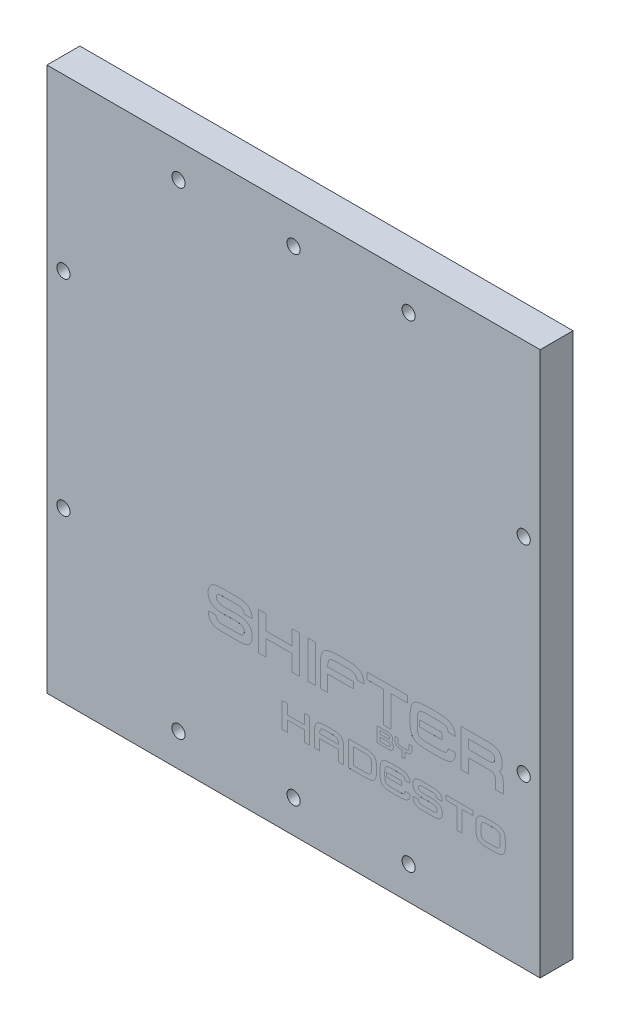
from build123d import *

# Parameters (mm, degrees)
SZKIC1_W                    = 150
SZKIC1_H                    = 10
DODANIE_WYCI_GNI_CIE1_DEPTH = 165.5
SZKIC3_W                    = 2.340552273
SZKIC3_H                    = 11.4427
WYTNIJ_WYCI_GNI_CIE4_DEPTH  = 0.001
SZKIC2_R                    = 2
WYTNIJ_WYCI_GNI_CIE5_DEPTH  = 10


with BuildPart() as part:
    # Szkic1 → Dodanie-wyciągnięcie1 (new body)
    with BuildSketch(Plane(origin=(0, 0, 0), x_dir=(1, 0, 0), z_dir=(0, 1, 0))):
        Rectangle(SZKIC1_W, SZKIC1_H)
    extrude(amount=DODANIE_WYCI_GNI_CIE1_DEPTH)

    # Szkic3 → Wytnij-wyciągnięcie4 (cut)
    # profile 1 of 18: a face of its own
    with BuildSketch(Plane.XY.offset(5)):
        with BuildLine():
            Line((-16.542512568, 42.832400391), (-22.123288858, 42.832400391))
            add(Edge.make_bspline(
                [(-22.123288858, 42.832400391), (-22.422042313, 42.83440431), (-22.858237206, 42.854045396), (-23.414230973, 42.947728336), (-23.788781499, 43.040027305), (-24.133562425, 43.16208995), (-24.448277119, 43.312277598), (-24.734944472, 43.48711761), (-24.987217214, 43.694905585), (-25.213935653, 43.923582429), (-25.40889511, 44.18272049), (-25.568697724, 44.470268147), (-25.704906368, 44.782595342), (-25.806269964, 45.123449133), (-25.905832807, 45.628008445), (-25.927296998, 46.024411422), (-25.928150611, 46.29519945)],
                knots=[0, 0, 0, 0, 0.151922302, 0.221134811, 0.286191508, 0.347688773, 0.406612918, 0.463100543, 0.517821253, 0.572256363, 0.626379647, 0.681995079, 0.739047103, 0.799173433, 0.862284251, 1, 1, 1, 1], degree=3))
            Line((-25.928150611, 46.29519945), (-23.554797806, 46.29519945))
            add(Edge.make_bspline(
                [(-23.554797806, 46.29519945), (-23.554751578, 46.180821676), (-23.543199145, 46.012793928), (-23.494151101, 45.800661123), (-23.448821313, 45.655663212), (-23.384262854, 45.524487166), (-23.308496532, 45.403352549), (-23.220325966, 45.291489786), (-23.112188471, 45.196830265), (-22.995870738, 45.107855531), (-22.862409534, 45.037017564), (-22.718445996, 44.971797356), (-22.558618614, 44.921453905), (-22.385425517, 44.881806383), (-22.127733043, 44.844186109), (-21.926944375, 44.830376724), (-21.788254849, 44.833232865)],
                knots=[0, 0, 0, 0, 0.130945227, 0.191386142, 0.248712215, 0.304229169, 0.357994818, 0.411967713, 0.466330735, 0.52187641, 0.57903531, 0.638605761, 0.702428631, 0.770231885, 0.841588023, 1, 1, 1, 1], degree=3))
            Line((-21.788254849, 44.833232865), (-16.971262384, 44.833232865))
            add(Edge.make_bspline(
                [(-16.971262384, 44.833232865), (-16.821141413, 44.833628326), (-16.603768932, 44.841681391), (-16.324615723, 44.865274956), (-16.13989718, 44.8953397), (-15.969591836, 44.924807053), (-15.774349275, 44.985256326), (-15.63567933, 45.034258072), (-15.553810807, 45.081579753)],
                knots=[0, 0, 0, 0, 0.310014709, 0.449362834, 0.57828042, 0.696618046, 0.805874912, 1, 1, 1, 1], degree=3))
            add(Edge.make_bspline(
                [(-15.553810807, 45.081579753), (-15.460602348, 45.133303576), (-15.331832672, 45.230409308), (-15.19807949, 45.397361959), (-15.115563301, 45.537486301), (-15.056089605, 45.695884437), (-14.988220052, 45.933334048), (-14.980933036, 46.126610238), (-14.977458596, 46.257713127)],
                knots=[0, 0, 0, 0, 0.232178092, 0.345784315, 0.463841982, 0.584405484, 0.713048125, 1, 1, 1, 1], degree=3))
            add(Edge.make_bspline(
                [(-14.977458596, 46.257713127), (-14.980271312, 46.40533732), (-15.00149924, 46.626881944), (-15.118055232, 46.890480367), (-15.230426364, 47.065929681), (-15.377935917, 47.22144953), (-15.626308287, 47.409416515), (-15.849207901, 47.507276559), (-16.005989575, 47.56036284)],
                knots=[0, 0, 0, 0, 0.249244707, 0.364726436, 0.480163662, 0.596825915, 0.721946619, 1, 1, 1, 1], degree=3))
            add(Edge.make_bspline(
                [(-16.005989575, 47.56036284), (-16.127688045, 47.602586001), (-16.323407595, 47.652868698), (-16.600262479, 47.703711254), (-16.83640478, 47.735935271), (-17.092731641, 47.761398711), (-17.473729914, 47.787855732), (-17.770225288, 47.789088397), (-17.974021516, 47.792309462)],
                knots=[0, 0, 0, 0, 0.194054864, 0.304223373, 0.424292964, 0.553297749, 0.692567507, 1, 1, 1, 1], degree=3))
            add(Edge.make_bspline(
                [(-17.974021516, 47.792309462), (-18.19583284, 47.791502098), (-18.562227009, 47.787132529), (-19.095478158, 47.767764039), (-19.574218875, 47.752477923), (-20.052959821, 47.737205105), (-20.589331817, 47.717682568), (-20.958854281, 47.713493879), (-21.183787896, 47.712651026)],
                knots=[0, 0, 0, 0, 0.207249272, 0.342308609, 0.498540821, 0.654773034, 0.789832371, 1, 1, 1, 1], degree=3))
            add(Edge.make_bspline(
                [(-21.183787896, 47.712651026), (-21.521268187, 47.715698564), (-22.011347572, 47.725391699), (-22.64087422, 47.782392924), (-23.063495877, 47.844340351), (-23.454221965, 47.917465826), (-23.914411838, 48.033270903), (-24.234064535, 48.156260402), (-24.431040598, 48.251516915)],
                knots=[0, 0, 0, 0, 0.30527379, 0.442865584, 0.571301332, 0.691382806, 0.802202654, 1, 1, 1, 1], degree=3))
            add(Edge.make_bspline(
                [(-24.431040598, 48.251516915), (-24.678585657, 48.374955388), (-25.02010852, 48.607182622), (-25.390618379, 49.003012411), (-25.610113018, 49.336822914), (-25.782951694, 49.705898653), (-25.948818692, 50.267042586), (-25.994557451, 50.716961898), (-25.99140878, 51.025504794)],
                knots=[0, 0, 0, 0, 0.246159863, 0.363761762, 0.480637741, 0.600407148, 0.72535946, 1, 1, 1, 1], degree=3))
            add(Edge.make_bspline(
                [(-25.99140878, 51.025504794), (-25.992671009, 51.30386528), (-25.962644752, 51.709810702), (-25.847204543, 52.222593888), (-25.731324459, 52.564909214), (-25.578261041, 52.874494673), (-25.328611286, 53.243448454), (-25.093054098, 53.479195229), (-24.913677003, 53.607375269)],
                knots=[0, 0, 0, 0, 0.287331641, 0.417924524, 0.541529787, 0.65938178, 0.773151266, 1, 1, 1, 1], degree=3))
            add(Edge.make_bspline(
                [(-24.913677003, 53.607375269), (-24.753614732, 53.724319382), (-24.485377703, 53.872690053), (-24.092205872, 54.022608316), (-23.760082019, 54.114353589), (-23.399191073, 54.187372908), (-22.861876031, 54.255882271), (-22.442534011, 54.278361983), (-22.153746495, 54.275100391)],
                knots=[0, 0, 0, 0, 0.205829485, 0.317155703, 0.436984505, 0.563784613, 0.699797751, 1, 1, 1, 1], degree=3))
            Line((-22.153746495, 54.275100391), (-16.844746045, 54.275100391))
            add(Edge.make_bspline(
                [(-16.844746045, 54.275100391), (-16.514040808, 54.272924598), (-16.032033705, 54.253763699), (-15.416670144, 54.159747702), (-15.002368741, 54.06776744), (-14.621519295, 53.945534416), (-14.272083177, 53.798761474), (-13.956715796, 53.622998872), (-13.674421528, 53.419373768), (-13.424590186, 53.189850015), (-13.209403882, 52.93059789), (-13.025222176, 52.646608417), (-12.877829866, 52.332975907), (-12.759765428, 51.994929061), (-12.648872615, 51.492234481), (-12.620484094, 51.096865101), (-12.620506057, 50.826358704)],
                knots=[0, 0, 0, 0, 0.159185356, 0.231380934, 0.299177103, 0.363086624, 0.423506478, 0.48118809, 0.536338715, 0.590564411, 0.643900735, 0.697976609, 0.752917048, 0.810175151, 0.869863143, 1, 1, 1, 1], degree=3))
            Line((-12.620506057, 50.826358704), (-15.071174403, 50.826358704))
            add(Edge.make_bspline(
                [(-15.071174403, 50.826358704), (-15.069084386, 50.941194158), (-15.085497121, 51.108674253), (-15.135082008, 51.32206839), (-15.189960397, 51.465470651), (-15.257396978, 51.598776984), (-15.343857263, 51.718369873), (-15.441143176, 51.830400105), (-15.558885497, 51.925475528), (-15.687276765, 52.01433989), (-15.834713334, 52.084984287), (-15.994579215, 52.149620804), (-16.170624962, 52.200007747), (-16.361646037, 52.240183375), (-16.646034333, 52.276891745), (-16.867710257, 52.291635872), (-17.020463182, 52.288325289)],
                knots=[0, 0, 0, 0, 0.12373596, 0.180989677, 0.235950535, 0.289116884, 0.341745777, 0.394885382, 0.448749002, 0.504633205, 0.563072603, 0.624754491, 0.690648222, 0.760423942, 0.835299916, 1, 1, 1, 1], degree=3))
            Line((-17.020463182, 52.288325289), (-22.027230156, 52.288325289))
            add(Edge.make_bspline(
                [(-22.027230156, 52.288325289), (-22.237115902, 52.286860891), (-22.540500366, 52.259159743), (-22.897172127, 52.117204324), (-23.106326436, 51.974149472), (-23.267138631, 51.785357048), (-23.427708095, 51.464386689), (-23.455416988, 51.182927545), (-23.458739104, 50.992704261)],
                knots=[0, 0, 0, 0, 0.28617742, 0.406448566, 0.51760179, 0.626596097, 0.739419835, 1, 1, 1, 1], degree=3))
            add(Edge.make_bspline(
                [(-23.458739104, 50.992704261), (-23.45695375, 50.885682649), (-23.439665203, 50.725253112), (-23.361059869, 50.52938136), (-23.283755313, 50.393993025), (-23.181156667, 50.270810543), (-23.054833178, 50.160932127), (-22.9080302, 50.05933582), (-22.738989471, 49.96858367), (-22.548166298, 49.88918654), (-22.334753976, 49.821303193), (-22.099638703, 49.76436891), (-21.841887333, 49.714057612), (-21.56171571, 49.677687015), (-21.14388052, 49.643420843), (-20.819267432, 49.632185419), (-20.595721208, 49.633825064)],
                knots=[0, 0, 0, 0, 0.091832613, 0.135566021, 0.179507576, 0.224524878, 0.271785124, 0.322123736, 0.37675359, 0.435361319, 0.498445969, 0.567862779, 0.641920655, 0.722688477, 0.809064572, 1, 1, 1, 1], degree=3))
            add(Edge.make_bspline(
                [(-20.595721208, 49.633825064), (-20.384712024, 49.631285659), (-20.041132218, 49.644982602), (-19.546760779, 49.663890455), (-19.113461183, 49.688023749), (-18.681605734, 49.710040531), (-18.196079055, 49.735661584), (-17.860013454, 49.74084446), (-17.655387773, 49.743941137)],
                knots=[0, 0, 0, 0, 0.215036783, 0.350500079, 0.504366675, 0.657438174, 0.791346006, 1, 1, 1, 1], degree=3))
            add(Edge.make_bspline(
                [(-17.655387773, 49.743941137), (-17.301296909, 49.744241875), (-16.787103202, 49.727570637), (-16.126156643, 49.665713964), (-15.682495499, 49.596133448), (-15.272134722, 49.515328707), (-14.790163515, 49.377024979), (-14.451388989, 49.248296027), (-14.246475303, 49.137131288)],
                knots=[0, 0, 0, 0, 0.304044834, 0.441512067, 0.569747136, 0.689567347, 0.800388045, 1, 1, 1, 1], degree=3))
            add(Edge.make_bspline(
                [(-14.246475303, 49.137131288), (-13.980059598, 49.001536034), (-13.616274354, 48.748407121), (-13.217615902, 48.328182965), (-12.980940618, 47.981234354), (-12.79664715, 47.599777454), (-12.617048256, 47.028830496), (-12.569768568, 46.570196797), (-12.571305258, 46.257713127)],
                knots=[0, 0, 0, 0, 0.254403592, 0.373969577, 0.491718452, 0.610755608, 0.733648628, 1, 1, 1, 1], degree=3))
            add(Edge.make_bspline(
                [(-12.571305258, 46.257713127), (-12.572216669, 45.966442467), (-12.597140005, 45.540817733), (-12.712795989, 45.002927774), (-12.829953285, 44.643718233), (-12.979623966, 44.31586119), (-13.223840642, 43.922559529), (-13.462019798, 43.672190527), (-13.639665455, 43.530583151)],
                knots=[0, 0, 0, 0, 0.288468082, 0.419707501, 0.543339316, 0.661573202, 0.775413558, 1, 1, 1, 1], degree=3))
            add(Edge.make_bspline(
                [(-13.639665455, 43.530583151), (-13.795597672, 43.404960412), (-14.068400603, 43.254275437), (-14.467840402, 43.09506499), (-14.816060597, 43.002058858), (-15.196834225, 42.924099613), (-15.775724033, 42.85171901), (-16.228909172, 42.833093055), (-16.542512568, 42.832400391)],
                knots=[0, 0, 0, 0, 0.196904714, 0.30637113, 0.424122327, 0.552441328, 0.690159053, 1, 1, 1, 1], degree=3))
        make_face()
    # profile 2 of 18: a face of its own
    with BuildSketch(Plane.XY.offset(5)):
        Polygon((1.874986347, 42.832400391), (-0.465565926, 42.832400391), (-0.465565926, 47.743108663), (-8.328322109, 47.743108663), (-8.328322109, 42.832400391), (-10.668874382, 42.832400391), (-10.668874382, 54.275100391), (-8.328322109, 54.275100391), (-8.328322109, 49.727540871), (-0.465565926, 49.727540871), (-0.465565926, 54.275100391), (1.874986347, 54.275100391), align=None)
    # profile 3 of 18: a face of its own
    with BuildSketch(Plane.XY.offset(5)):
        with Locations((5.535760047, 48.553750391)):
            Rectangle(SZKIC3_W, SZKIC3_H)
    # profile 4 of 18: a face of its own
    with BuildSketch(Plane.XY.offset(5)):
        with BuildLine():
            Line((10.353923959, 49.680682967), (18.204965667, 49.680682967))
            Line((18.204965667, 49.680682967), (18.204965667, 47.775909196))
            Line((18.204965667, 47.775909196), (10.353923959, 47.775909196))
            Line((10.353923959, 47.775909196), (10.353923959, 42.832400391))
            Line((10.353923959, 42.832400391), (8.12348776, 42.832400391))
            Line((8.12348776, 42.832400391), (8.139888026, 48.766953852))
            add(Edge.make_bspline(
                [(8.139888026, 48.766953852), (8.136223824, 49.129546201), (8.151663373, 49.65378104), (8.18690294, 50.325673132), (8.230349031, 50.769284594), (8.280490386, 51.172791681), (8.358692705, 51.634403035), (8.445107441, 51.956217604), (8.512408357, 52.154780264)],
                knots=[0, 0, 0, 0, 0.317800877, 0.459770024, 0.58976232, 0.708488739, 0.816214059, 1, 1, 1, 1], degree=3))
            add(Edge.make_bspline(
                [(8.512408357, 52.154780264), (8.582274378, 52.353614737), (8.71519439, 52.637438112), (8.942050988, 52.98197737), (9.138715725, 53.211040751), (9.360227911, 53.415379149), (9.692141158, 53.661457269), (9.973024409, 53.80268049), (10.168835241, 53.881494003)],
                knots=[0, 0, 0, 0, 0.255571256, 0.378596101, 0.499596222, 0.62099289, 0.743641103, 1, 1, 1, 1], degree=3))
            add(Edge.make_bspline(
                [(10.168835241, 53.881494003), (10.377082685, 53.968033784), (10.71953271, 54.063973302), (11.206894843, 54.167138049), (11.6306627, 54.226966509), (12.093719739, 54.280280402), (12.790592332, 54.325932897), (13.333899816, 54.338822675), (13.70894984, 54.338358561)],
                knots=[0, 0, 0, 0, 0.188096828, 0.296817254, 0.416307633, 0.54573704, 0.686461057, 1, 1, 1, 1], degree=3))
            Line((13.70894984, 54.338358561), (15.775383378, 54.338358561))
            add(Edge.make_bspline(
                [(15.775383378, 54.338358561), (16.255209059, 54.338412348), (16.945479394, 54.31948511), (17.824275929, 54.240879395), (18.39191393, 54.156796874), (18.900204065, 54.054062463), (19.463954239, 53.888406519), (19.84825419, 53.724997963), (20.067567326, 53.581603422)],
                knots=[0, 0, 0, 0, 0.326658008, 0.469759159, 0.600360482, 0.717142396, 0.822452319, 1, 1, 1, 1], degree=3))
            add(Edge.make_bspline(
                [(20.067567326, 53.581603422), (20.270837029, 53.449322563), (20.551412534, 53.204296377), (20.848042374, 52.79975726), (21.047041147, 52.453349125), (21.207848937, 52.061357752), (21.398188792, 51.465447445), (21.472882524, 50.984445776), (21.510790749, 50.652984462)],
                knots=[0, 0, 0, 0, 0.215512447, 0.327131176, 0.444654477, 0.569707877, 0.702963159, 1, 1, 1, 1], degree=3))
            Line((21.510790749, 50.652984462), (19.29441192, 50.652984462))
            add(Edge.make_bspline(
                [(19.29441192, 50.652984462), (19.253817319, 50.830632383), (19.174942613, 51.083649952), (19.027524262, 51.391592759), (18.899628808, 51.585413537), (18.755971052, 51.753524747), (18.542709387, 51.944006075), (18.351939602, 52.042821721), (18.219023038, 52.0891792)],
                knots=[0, 0, 0, 0, 0.291343801, 0.422029009, 0.544636847, 0.661527919, 0.774773501, 1, 1, 1, 1], degree=3))
            add(Edge.make_bspline(
                [(18.219023038, 52.0891792), (18.09319646, 52.1353921), (17.877232283, 52.177426153), (17.562237386, 52.224204051), (17.266654904, 52.253499004), (16.931477541, 52.276693371), (16.40348422, 52.297990426), (15.98713667, 52.307902106), (15.695724942, 52.304725555)],
                knots=[0, 0, 0, 0, 0.157646713, 0.259244268, 0.376058952, 0.508256356, 0.655950337, 1, 1, 1, 1], degree=3))
            Line((15.695724942, 52.304725555), (13.821408808, 52.304725555))
            add(Edge.make_bspline(
                [(13.821408808, 52.304725555), (13.497975016, 52.303921956), (13.036562209, 52.294028746), (12.453870568, 52.252939014), (12.087623734, 52.209917474), (11.769433331, 52.151292861), (11.433151857, 52.070181379), (11.210571745, 51.981220496), (11.089593042, 51.899404691)],
                knots=[0, 0, 0, 0, 0.347896457, 0.49613181, 0.628133571, 0.744281889, 0.843901062, 1, 1, 1, 1], degree=3))
            add(Edge.make_bspline(
                [(11.089593042, 51.899404691), (10.967170148, 51.823022711), (10.814408676, 51.653779218), (10.657200962, 51.377480222), (10.559466136, 51.117423404), (10.477762448, 50.817757718), (10.390625634, 50.336467186), (10.361540518, 49.951035556), (10.353923959, 49.680682967)],
                knots=[0, 0, 0, 0, 0.177190849, 0.27882497, 0.393352803, 0.521096447, 0.664120496, 1, 1, 1, 1], degree=3))
        make_face()
    # profile 5 of 18: a face of its own
    with BuildSketch(Plane.XY.offset(5)):
        Polygon((34.670832907, 52.274267918), (29.647665667, 52.274267918), (29.647665667, 42.832400391), (27.307113394, 42.832400391), (27.307113394, 52.274267918), (22.300346421, 52.274267918), (22.300346421, 54.275100391), (34.670832907, 54.275100391), align=None)
    # profile 6 of 18: a face of its own
    with BuildSketch(Plane.XY.offset(5)):
        with BuildLine():
            Line((43.43091794, 42.832400391), (40.968535118, 42.832400391))
            add(Edge.make_bspline(
                [(40.968535118, 42.832400391), (40.60058593, 42.833056305), (40.06825061, 42.844083204), (39.385642583, 42.884778609), (38.93296567, 42.928242202), (38.521359549, 42.987433129), (38.047403672, 43.07165289), (37.716125182, 43.161533809), (37.512764746, 43.237721255)],
                knots=[0, 0, 0, 0, 0.315853452, 0.456901686, 0.586909503, 0.706079852, 0.813768451, 1, 1, 1, 1], degree=3))
            add(Edge.make_bspline(
                [(37.512764746, 43.237721255), (37.315728976, 43.308009758), (37.037146251, 43.446637441), (36.699043067, 43.679065409), (36.476653103, 43.880646821), (36.274342821, 44.10202241), (36.037313876, 44.438429081), (35.893724181, 44.716693386), (35.821194434, 44.915234196)],
                knots=[0, 0, 0, 0, 0.254655329, 0.377777486, 0.499185872, 0.619886156, 0.742779715, 1, 1, 1, 1], degree=3))
            add(Edge.make_bspline(
                [(35.821194434, 44.915234196), (35.744043857, 45.118426625), (35.657336607, 45.450403965), (35.566766037, 45.923288649), (35.513672184, 46.335879589), (35.464617841, 46.78788473), (35.426218548, 47.470835579), (35.413626065, 48.002990955), (35.413530675, 48.371004568)],
                knots=[0, 0, 0, 0, 0.1862133, 0.294014373, 0.413080626, 0.543143086, 0.684177498, 1, 1, 1, 1], degree=3))
            add(Edge.make_bspline(
                [(35.413530675, 48.371004568), (35.412936909, 48.763899205), (35.421050273, 49.33054653), (35.459246675, 50.05605102), (35.49899348, 50.532586306), (35.547156871, 50.965713706), (35.622299257, 51.455469171), (35.702364402, 51.797455125), (35.767307846, 52.007177869)],
                knots=[0, 0, 0, 0, 0.321609357, 0.463728706, 0.594586506, 0.712970982, 0.820379201, 1, 1, 1, 1], degree=3))
            add(Edge.make_bspline(
                [(35.767307846, 52.007177869), (35.83422884, 52.22084636), (35.960580263, 52.527127678), (36.186872055, 52.895997494), (36.379192316, 53.139971538), (36.594632215, 53.359533756), (36.923232449, 53.615618743), (37.200046647, 53.766517136), (37.395619987, 53.846350576)],
                knots=[0, 0, 0, 0, 0.264263494, 0.388825993, 0.509593675, 0.630160731, 0.750928413, 1, 1, 1, 1], degree=3))
            add(Edge.make_bspline(
                [(37.395619987, 53.846350576), (37.604824373, 53.936854215), (37.950123758, 54.038589509), (38.443057608, 54.143397241), (38.872804041, 54.207097563), (39.344869683, 54.258393767), (40.057821571, 54.308840807), (40.614554399, 54.323459087), (40.998992755, 54.321958295)],
                knots=[0, 0, 0, 0, 0.186673139, 0.294793961, 0.413464869, 0.543078359, 0.684474125, 1, 1, 1, 1], degree=3))
            Line((40.998992755, 54.321958295), (43.463718472, 54.321958295))
            add(Edge.make_bspline(
                [(43.463718472, 54.321958295), (43.938862705, 54.320203949), (44.625895517, 54.300588702), (45.502134707, 54.208583041), (46.078559169, 54.11230024), (46.601824345, 53.99350365), (47.201504859, 53.8015602), (47.611708877, 53.611042169), (47.851961122, 53.452744187)],
                knots=[0, 0, 0, 0, 0.314844944, 0.454823659, 0.583341739, 0.701810237, 0.809960191, 1, 1, 1, 1], degree=3))
            add(Edge.make_bspline(
                [(47.851961122, 53.452744187), (48.067805964, 53.313458983), (48.367020437, 53.069970671), (48.679214178, 52.669305056), (48.870893991, 52.343640434), (49.018892871, 51.986322437), (49.162747212, 51.455934757), (49.199467621, 51.034132015), (49.199125843, 50.746700269)],
                knots=[0, 0, 0, 0, 0.243950048, 0.361591219, 0.48010578, 0.601286494, 0.727241657, 1, 1, 1, 1], degree=3))
            Line((49.199125843, 50.746700269), (46.952289377, 50.746700269))
            add(Edge.make_bspline(
                [(46.952289377, 50.746700269), (46.950173465, 50.914216269), (46.933249927, 51.160442393), (46.829300311, 51.457243325), (46.732765178, 51.648663216), (46.599602042, 51.810394898), (46.38295567, 51.998773839), (46.181896844, 52.091724592), (46.040903157, 52.136037103)],
                knots=[0, 0, 0, 0, 0.281221084, 0.405304002, 0.523085054, 0.637090674, 0.752606565, 1, 1, 1, 1], degree=3))
            add(Edge.make_bspline(
                [(46.040903157, 52.136037103), (45.909067367, 52.17464452), (45.685527921, 52.215464552), (45.357175994, 52.25107215), (45.047007313, 52.276516474), (44.693178449, 52.297809414), (44.133923822, 52.31560906), (43.692605373, 52.322927904), (43.384060036, 52.321125821)],
                knots=[0, 0, 0, 0, 0.154176449, 0.254889692, 0.37115572, 0.503932808, 0.653245043, 1, 1, 1, 1], degree=3))
            Line((43.384060036, 52.321125821), (41.111451724, 52.321125821))
            add(Edge.make_bspline(
                [(41.111451724, 52.321125821), (40.784879881, 52.320478249), (40.318051183, 52.310116527), (39.728283243, 52.269517972), (39.355885514, 52.225965791), (39.032111498, 52.167997932), (38.687804122, 52.085743817), (38.458914494, 51.997509192), (38.332778054, 51.915804957)],
                knots=[0, 0, 0, 0, 0.345644478, 0.493985201, 0.625519724, 0.742252533, 0.841884301, 1, 1, 1, 1], degree=3))
            add(Edge.make_bspline(
                [(38.332778054, 51.915804957), (38.209061774, 51.833443052), (38.048617236, 51.656765416), (37.898372694, 51.35926945), (37.80234677, 51.080480559), (37.72226188, 50.757700477), (37.646751989, 50.236346808), (37.627380703, 49.820220848), (37.625223714, 49.528394781)],
                knots=[0, 0, 0, 0, 0.172182951, 0.272744527, 0.386755583, 0.515243516, 0.659813711, 1, 1, 1, 1], degree=3))
            Line((37.625223714, 49.528394781), (37.627566609, 47.923511591))
            add(Edge.make_bspline(
                [(37.627566609, 47.923511591), (37.626891047, 47.593092448), (37.635554035, 47.121468762), (37.706987468, 46.531126992), (37.777885272, 46.166371253), (37.869652707, 45.853275373), (38.014992757, 45.525904117), (38.168446569, 45.323759612), (38.295291732, 45.231525043)],
                knots=[0, 0, 0, 0, 0.347584885, 0.494830619, 0.624602041, 0.737837282, 0.837036243, 1, 1, 1, 1], degree=3))
            add(Edge.make_bspline(
                [(38.295291732, 45.231525043), (38.415470932, 45.145915949), (38.639900887, 45.052775719), (38.978276026, 44.962041594), (39.301131769, 44.902381803), (39.671972311, 44.856554191), (40.264059468, 44.812655556), (40.733261963, 44.799592207), (41.062250925, 44.800432332)],
                knots=[0, 0, 0, 0, 0.155206199, 0.255592002, 0.370997274, 0.502801868, 0.651395086, 1, 1, 1, 1], degree=3))
            Line((41.062250925, 44.800432332), (43.400460303, 44.800432332))
            add(Edge.make_bspline(
                [(43.400460303, 44.800432332), (43.716033311, 44.798650702), (44.165941186, 44.805856038), (44.734571903, 44.823680713), (45.091514411, 44.84510184), (45.402498124, 44.870232417), (45.727023702, 44.905749613), (45.945991077, 44.946290708), (46.073703689, 44.985521051)],
                knots=[0, 0, 0, 0, 0.352451819, 0.502580475, 0.635403884, 0.751817299, 0.851038538, 1, 1, 1, 1], degree=3))
            add(Edge.make_bspline(
                [(46.073703689, 44.985521051), (46.214761062, 45.028112184), (46.417111897, 45.118989494), (46.631125467, 45.311595937), (46.760984791, 45.47918579), (46.859063507, 45.675945186), (46.953365567, 45.989611981), (46.972416973, 46.245186002), (46.968689643, 46.421715789)],
                knots=[0, 0, 0, 0, 0.24156096, 0.354454704, 0.467197092, 0.585822661, 0.711271118, 1, 1, 1, 1], degree=3))
            Line((46.968689643, 46.421715789), (49.22958348, 46.421715789))
            add(Edge.make_bspline(
                [(49.22958348, 46.421715789), (49.230097622, 46.064842368), (49.19216756, 45.54714882), (49.025503305, 44.903510748), (48.85351015, 44.490822927), (48.634412134, 44.1265481), (48.272910225, 43.705927736), (47.924778333, 43.473283379), (47.676243984, 43.354866014)],
                knots=[0, 0, 0, 0, 0.294114227, 0.424501136, 0.545829666, 0.660956259, 0.7731031, 1, 1, 1, 1], degree=3))
            add(Edge.make_bspline(
                [(47.676243984, 43.354866014), (47.464912682, 43.254764253), (47.102207562, 43.135546131), (46.564847707, 43.028437096), (46.066434091, 42.957626779), (45.50227837, 42.898748718), (44.616392, 42.846961195), (43.918497908, 42.828993781), (43.43091794, 42.832400391)],
                knots=[0, 0, 0, 0, 0.162710407, 0.264981933, 0.38160847, 0.513497487, 0.660216093, 1, 1, 1, 1], degree=3))
        make_face()
    # profile 7 of 18: a face of its own
    with BuildSketch(Plane.XY.offset(5)):
        Polygon((45.17637484, 47.775909196), (38.332778054, 47.799338147), (38.332778054, 49.697083233), (45.17637484, 49.697083233), align=None)
    # profile 8 of 18: a face of its own
    with BuildSketch(Plane.XY.offset(5)):
        with BuildLine():
            Line((63.788334054, 42.832400391), (61.464182047, 42.832400391))
            Line((61.464182047, 42.832400391), (61.464182047, 45.015978688))
            add(Edge.make_bspline(
                [(61.464182047, 45.015978688), (61.463587156, 45.191086605), (61.453521007, 45.44512577), (61.404074283, 45.766974591), (61.359356385, 45.979485189), (61.2952878, 46.170728656), (61.218370206, 46.341870152), (61.12913159, 46.495053387), (61.022672444, 46.627809995), (60.897750388, 46.742866783), (60.753039743, 46.841461342), (60.587997631, 46.92615938), (60.401328237, 46.993730701), (60.19301329, 47.044529821), (59.875381317, 47.095138398), (59.624663463, 47.109726648), (59.451635098, 47.108184073)],
                knots=[0, 0, 0, 0, 0.155011784, 0.224175814, 0.287859163, 0.346835827, 0.402172914, 0.453585721, 0.503208761, 0.55209072, 0.603247683, 0.657619286, 0.715748493, 0.778404625, 0.846993692, 1, 1, 1, 1], degree=3))
            Line((59.451635098, 47.108184073), (53.266391855, 47.091783807))
            Line((53.266391855, 47.091783807), (53.266391855, 42.832400391))
            Line((53.266391855, 42.832400391), (50.989097751, 42.832400391))
            Line((50.989097751, 42.832400391), (50.989097751, 54.275100391))
            Line((50.989097751, 54.275100391), (59.292318226, 54.275100391))
            add(Edge.make_bspline(
                [(59.292318226, 54.275100391), (59.629522519, 54.277823501), (60.116953355, 54.25347755), (60.738166914, 54.166928674), (61.148237826, 54.080849225), (61.518437339, 53.962173264), (61.949187273, 53.782762266), (62.234832155, 53.598250901), (62.398997219, 53.455087083)],
                knots=[0, 0, 0, 0, 0.308563432, 0.445716134, 0.573699083, 0.691455971, 0.800969481, 1, 1, 1, 1], degree=3))
            add(Edge.make_bspline(
                [(62.398997219, 53.455087083), (62.574347885, 53.298789654), (62.803200113, 53.023062416), (63.043417941, 52.604027362), (63.187556567, 52.250343592), (63.303546526, 51.864713247), (63.409040464, 51.284747307), (63.440763003, 50.829866827), (63.439242674, 50.517096542)],
                knots=[0, 0, 0, 0, 0.218918775, 0.33232409, 0.450084974, 0.574981528, 0.707931514, 1, 1, 1, 1], degree=3))
            add(Edge.make_bspline(
                [(63.439242674, 50.517096542), (63.436538994, 50.236350811), (63.417543249, 49.832618123), (63.305625937, 49.333929449), (63.198079873, 49.021946554), (63.051734102, 48.757532485), (62.821466376, 48.464034431), (62.588379807, 48.312571362), (62.422426171, 48.246831124)],
                knots=[0, 0, 0, 0, 0.319412201, 0.455762304, 0.579143684, 0.692631121, 0.79729967, 1, 1, 1, 1], degree=3))
            add(Edge.make_bspline(
                [(62.422426171, 48.246831124), (62.531912145, 48.220350294), (62.69348586, 48.171083277), (62.886675994, 48.063632712), (63.022402142, 47.975773879), (63.14423214, 47.868384451), (63.257031702, 47.748296095), (63.361019857, 47.615326669), (63.449442669, 47.465346899), (63.52983876, 47.30264899), (63.599414644, 47.125487051), (63.657983591, 46.93340384), (63.70715717, 46.727736741), (63.7443796, 46.506988294), (63.778461841, 46.184401177), (63.789808773, 45.934645788), (63.788334054, 45.763362246)],
                knots=[0, 0, 0, 0, 0.109952973, 0.162653118, 0.214708369, 0.266962896, 0.320180924, 0.374896837, 0.430802819, 0.489253564, 0.5513401, 0.615754487, 0.684500673, 0.756955777, 0.83340111, 1, 1, 1, 1], degree=3))
            Line((63.788334054, 45.763362246), (63.788334054, 42.832400391))
        make_face()
        with BuildLine():
            Line((59.468035364, 52.068093143), (53.266391855, 52.068093143))
            Line((53.266391855, 52.068093143), (53.266391855, 49.298791055))
            Line((53.266391855, 49.298791055), (59.468035364, 49.298791055))
            add(Edge.make_bspline(
                [(59.468035364, 49.298791055), (59.713460564, 49.302597378), (60.068182937, 49.328025959), (60.48744934, 49.486550085), (60.730164252, 49.648004027), (60.920683054, 49.856529249), (61.105179387, 50.214119895), (61.14711558, 50.5265248), (61.145548304, 50.739671583)],
                knots=[0, 0, 0, 0, 0.292647434, 0.414933396, 0.527701918, 0.635233364, 0.746265615, 1, 1, 1, 1], degree=3))
            add(Edge.make_bspline(
                [(61.145548304, 50.739671583), (61.147844386, 50.936928083), (61.10350185, 51.227504629), (60.919457494, 51.55642004), (60.728288947, 51.747959429), (60.484699774, 51.893461725), (60.066951407, 52.04352407), (59.712935234, 52.06434136), (59.468035364, 52.068093143)],
                knots=[0, 0, 0, 0, 0.243091442, 0.351382042, 0.45789428, 0.571595969, 0.697253566, 1, 1, 1, 1], degree=3))
        make_face(mode=Mode.SUBTRACT)
    # profile 9 of 18: a face of its own
    with BuildSketch(Plane.XY.offset(5)):
        Polygon((4.900127285, 26.250960101), (3.339759103, 26.250960101), (3.339759103, 29.524765615), (-1.902078352, 29.524765615), (-1.902078352, 26.250960101), (-3.462446534, 26.250960101), (-3.462446534, 33.879426767), (-1.902078352, 33.879426767), (-1.902078352, 30.84772042), (3.339759103, 30.84772042), (3.339759103, 33.879426767), (4.900127285, 33.879426767), align=None)
    # profile 10 of 18: a face of its own
    with BuildSketch(Plane.XY.offset(5)):
        with BuildLine():
            Line((13.701603466, 29.524765615), (7.941205213, 29.524765615))
            Line((7.941205213, 29.524765615), (7.941205213, 26.250960101))
            Line((7.941205213, 26.250960101), (6.380837031, 26.250960101))
            Line((6.380837031, 26.250960101), (6.380837031, 30.758690404))
            add(Edge.make_bspline(
                [(6.380837031, 30.758690404), (6.380913782, 30.909736983), (6.386323231, 31.131863315), (6.407674217, 31.421242293), (6.428705939, 31.624614468), (6.459093338, 31.817671836), (6.493048991, 32.001222133), (6.532989243, 32.175150342), (6.58226459, 32.338820302), (6.634422714, 32.493643844), (6.69415279, 32.638835895), (6.761168703, 32.773567669), (6.832878914, 32.900156012), (6.912857567, 33.015753042), (7.026416357, 33.155624631), (7.120110742, 33.251034334), (7.189916829, 33.304636486)],
                knots=[0, 0, 0, 0, 0.164418408, 0.241695767, 0.315790914, 0.386880089, 0.454344293, 0.518948986, 0.580990108, 0.640308359, 0.696715684, 0.751710512, 0.804005532, 0.854934813, 0.904496359, 1, 1, 1, 1], degree=3))
            add(Edge.make_bspline(
                [(7.189916829, 33.304636486), (7.319814898, 33.409300439), (7.551492652, 33.538765349), (7.901367696, 33.661605513), (8.213276034, 33.742532643), (8.563355375, 33.80343568), (9.104513422, 33.866142015), (9.531611953, 33.878023579), (9.828016788, 33.879426767)],
                knots=[0, 0, 0, 0, 0.181810588, 0.287672901, 0.404740533, 0.533690843, 0.675806459, 1, 1, 1, 1], degree=3))
            Line((9.828016788, 33.879426767), (11.703894853, 33.879426767))
            add(Edge.make_bspline(
                [(11.703894853, 33.879426767), (12.004927368, 33.877277127), (12.438975499, 33.867304515), (12.989438076, 33.801879833), (13.345916912, 33.738846701), (13.665082785, 33.659674595), (14.020985832, 33.530453833), (14.258762739, 33.400896211), (14.391976575, 33.293702975)],
                knots=[0, 0, 0, 0, 0.323218464, 0.464989803, 0.594402708, 0.711468114, 0.81732855, 1, 1, 1, 1], degree=3))
            add(Edge.make_bspline(
                [(14.391976575, 33.293702975), (14.541231133, 33.175741789), (14.735936206, 32.954979622), (14.931545615, 32.606540355), (15.055613223, 32.305134231), (15.149378149, 31.967840011), (15.241042165, 31.450567166), (15.263018008, 31.041499259), (15.263533578, 30.758690404)],
                knots=[0, 0, 0, 0, 0.205459765, 0.315072994, 0.431639834, 0.55767728, 0.693518199, 1, 1, 1, 1], degree=3))
            Line((15.263533578, 30.758690404), (15.263533578, 26.250960101))
            Line((15.263533578, 26.250960101), (13.701603466, 26.250960101))
            Line((13.701603466, 26.250960101), (13.701603466, 29.524765615))
        make_face()
        with BuildLine():
            Line((7.939643283, 30.84772042), (13.692231885, 30.84772042))
            add(Edge.make_bspline(
                [(13.692231885, 30.84772042), (13.692614771, 31.016487841), (13.675541623, 31.257944511), (13.625240301, 31.562144139), (13.572957624, 31.754532135), (13.505551342, 31.922450094), (13.401805178, 32.108834462), (13.293543768, 32.220540356), (13.212719341, 32.276886472)],
                knots=[0, 0, 0, 0, 0.3240439, 0.464160161, 0.591813718, 0.70624003, 0.81108294, 1, 1, 1, 1], degree=3))
            add(Edge.make_bspline(
                [(13.212719341, 32.276886472), (13.13672685, 32.329300813), (12.997490002, 32.38809786), (12.788072067, 32.445397323), (12.589394321, 32.481774088), (12.362108577, 32.511145022), (12.000129379, 32.538229419), (11.713889023, 32.545121223), (11.513339379, 32.545538452)],
                knots=[0, 0, 0, 0, 0.158283496, 0.258942466, 0.374127982, 0.506345229, 0.654083339, 1, 1, 1, 1], degree=3))
            Line((11.513339379, 32.545538452), (9.998267171, 32.545538452))
            add(Edge.make_bspline(
                [(9.998267171, 32.545538452), (9.808685645, 32.544507907), (9.537366804, 32.539275643), (9.194687347, 32.509742385), (8.978399925, 32.478395887), (8.788442097, 32.440805816), (8.585092017, 32.380559097), (8.449007196, 32.320824312), (8.375421784, 32.265952962)],
                knots=[0, 0, 0, 0, 0.341247183, 0.4879997, 0.618650443, 0.734416625, 0.836096831, 1, 1, 1, 1], degree=3))
            add(Edge.make_bspline(
                [(8.375421784, 32.265952962), (8.301336782, 32.211097077), (8.20096734, 32.102591527), (8.1095333, 31.920036565), (8.048282568, 31.75400408), (8.000875515, 31.563334817), (7.953660785, 31.259320699), (7.941920311, 31.017210232), (7.939643283, 30.84772042)],
                knots=[0, 0, 0, 0, 0.180375142, 0.283893021, 0.398091347, 0.526428741, 0.667896118, 1, 1, 1, 1], degree=3))
        make_face(mode=Mode.SUBTRACT)
    # profile 11 of 18: a face of its own
    with BuildSketch(Plane.XY.offset(5)):
        with BuildLine():
            Line((21.98920464, 26.24002659), (16.655213308, 26.24002659))
            Line((16.655213308, 26.24002659), (16.655213308, 33.879426767))
            Line((16.655213308, 33.879426767), (21.809582677, 33.879426767))
            add(Edge.make_bspline(
                [(21.809582677, 33.879426767), (22.064359027, 33.879118831), (22.433874236, 33.867147579), (22.905658225, 33.812909103), (23.219242057, 33.761747139), (23.503955785, 33.690897362), (23.835788058, 33.584235956), (24.061682878, 33.472427084), (24.196211888, 33.384294922)],
                knots=[0, 0, 0, 0, 0.309719935, 0.448550711, 0.5769045, 0.695521955, 0.804763459, 1, 1, 1, 1], degree=3))
            add(Edge.make_bspline(
                [(24.196211888, 33.384294922), (24.317280874, 33.305850883), (24.485944698, 33.169785438), (24.677966419, 32.955063624), (24.80314503, 32.777611603), (24.91082103, 32.583966038), (25.037827967, 32.300172551), (25.097434669, 32.069290045), (25.128684165, 31.911394826)],
                knots=[0, 0, 0, 0, 0.241210856, 0.36025221, 0.480825478, 0.603645366, 0.730355611, 1, 1, 1, 1], degree=3))
            add(Edge.make_bspline(
                [(25.128684165, 31.911394826), (25.153269605, 31.779967898), (25.186362075, 31.565910912), (25.210625911, 31.258081415), (25.232806204, 30.981289053), (25.24491648, 30.67335882), (25.261179634, 30.200196999), (25.263063581, 29.829335863), (25.263010154, 29.571623519)],
                knots=[0, 0, 0, 0, 0.170984739, 0.276567168, 0.39470196, 0.525968882, 0.67048687, 1, 1, 1, 1], degree=3))
            add(Edge.make_bspline(
                [(25.263010154, 29.571623519), (25.264889743, 29.283264059), (25.246155733, 28.867580355), (25.178366227, 28.339785083), (25.109547371, 27.996138174), (25.017809441, 27.689212071), (24.876027715, 27.340587975), (24.732735796, 27.109947693), (24.616371088, 26.981943393)],
                knots=[0, 0, 0, 0, 0.317701801, 0.457735795, 0.585991963, 0.703412898, 0.810158247, 1, 1, 1, 1], degree=3))
            add(Edge.make_bspline(
                [(24.616371088, 26.981943393), (24.560164114, 26.917057558), (24.461550516, 26.830996648), (24.317347815, 26.728430849), (24.198857632, 26.653998908), (24.068175203, 26.58954799), (23.928641041, 26.528214546), (23.77978439, 26.47203873), (23.619827566, 26.423851671), (23.450579718, 26.380043026), (23.270522435, 26.343444252), (23.081727236, 26.309592962), (22.882391543, 26.285734418), (22.673558789, 26.265569549), (22.37490864, 26.243103781), (22.14537393, 26.24181117), (21.98920464, 26.24002659)],
                knots=[0, 0, 0, 0, 0.091643919, 0.139592265, 0.18939982, 0.241248908, 0.295410294, 0.352558216, 0.411446484, 0.474174328, 0.539654988, 0.608107161, 0.679455027, 0.75449571, 0.832728872, 1, 1, 1, 1], degree=3))
        make_face()
        with BuildLine():
            Line((23.701080043, 29.613795632), (23.701080043, 30.546267908))
            add(Edge.make_bspline(
                [(23.701080043, 30.546267908), (23.701883202, 30.729850267), (23.689802866, 30.993058014), (23.65092071, 31.326637522), (23.606849963, 31.539505189), (23.552995195, 31.728625216), (23.487113637, 31.893559563), (23.406656297, 32.033475528), (23.312653586, 32.152145285), (23.197176517, 32.249401341), (23.060775747, 32.333594881), (22.898004096, 32.399963769), (22.712450739, 32.459056753), (22.500556446, 32.500303221), (22.170091641, 32.547196229), (21.907482605, 32.553679041), (21.725238451, 32.554910032)],
                knots=[0, 0, 0, 0, 0.163967852, 0.235227714, 0.299821125, 0.357970455, 0.410753136, 0.458068257, 0.50173217, 0.545276972, 0.592270842, 0.644374718, 0.701902952, 0.766040793, 0.836961238, 1, 1, 1, 1], degree=3))
            Line((21.725238451, 32.554910032), (18.226515, 32.554910032))
            Line((18.226515, 32.554910032), (18.226515, 27.573914905))
            Line((18.226515, 27.573914905), (21.820516188, 27.573914905))
            add(Edge.make_bspline(
                [(21.820516188, 27.573914905), (22.00650919, 27.574720174), (22.273489646, 27.582271575), (22.609217541, 27.627374227), (22.820662933, 27.672436975), (23.005368734, 27.72698568), (23.205038317, 27.816098535), (23.329923948, 27.90992274), (23.394941741, 27.983140595)],
                knots=[0, 0, 0, 0, 0.334560306, 0.479099002, 0.608330904, 0.722900218, 0.824679382, 1, 1, 1, 1], degree=3))
            add(Edge.make_bspline(
                [(23.394941741, 27.983140595), (23.452520135, 28.05481782), (23.523399286, 28.187205919), (23.584591684, 28.391706142), (23.629428223, 28.581833632), (23.659616343, 28.800498199), (23.696158213, 29.146761625), (23.699689905, 29.421718425), (23.701080043, 29.613795632)],
                knots=[0, 0, 0, 0, 0.163304622, 0.264521828, 0.379735026, 0.51106061, 0.65745786, 1, 1, 1, 1], degree=3))
        make_face(mode=Mode.SUBTRACT)
    # profile 12 of 18: a face of its own
    with BuildSketch(Plane.XY.offset(5)):
        with BuildLine():
            Line((31.604446409, 26.250960101), (29.962857861, 26.250960101))
            add(Edge.make_bspline(
                [(29.962857861, 26.250960101), (29.717558402, 26.251397376), (29.362668189, 26.258748642), (28.907596171, 26.285878912), (28.605811563, 26.314854641), (28.331407482, 26.354315259), (28.015436897, 26.410461766), (27.794584571, 26.470382379), (27.659010946, 26.52117401)],
                knots=[0, 0, 0, 0, 0.315853452, 0.456901686, 0.586909503, 0.706079852, 0.813768451, 1, 1, 1, 1], degree=3))
            add(Edge.make_bspline(
                [(27.659010946, 26.52117401), (27.527653767, 26.568033012), (27.34193195, 26.660451467), (27.116529827, 26.815403445), (26.968269851, 26.949791054), (26.83339633, 27.09737478), (26.675377033, 27.321645894), (26.57965057, 27.50715543), (26.531297405, 27.63951597)],
                knots=[0, 0, 0, 0, 0.254655329, 0.377777486, 0.499185872, 0.619886156, 0.742779715, 1, 1, 1, 1], degree=3))
            add(Edge.make_bspline(
                [(26.531297405, 27.63951597), (26.479863687, 27.774977589), (26.422058854, 27.996295817), (26.361678474, 28.311552272), (26.326282571, 28.586612899), (26.293579677, 28.88794966), (26.267980148, 29.343250225), (26.259585159, 29.698020477), (26.259521566, 29.943362885)],
                knots=[0, 0, 0, 0, 0.1862133, 0.294014373, 0.413080626, 0.543143086, 0.684177498, 1, 1, 1, 1], degree=3))
            add(Edge.make_bspline(
                [(26.259521566, 29.943362885), (26.259125722, 30.205292643), (26.264534631, 30.583057526), (26.289998899, 31.066727187), (26.316496769, 31.384417377), (26.348605696, 31.673168977), (26.398700621, 31.999672621), (26.452077384, 32.227663256), (26.495373013, 32.367478419)],
                knots=[0, 0, 0, 0, 0.321609357, 0.463728706, 0.594586506, 0.712970982, 0.820379201, 1, 1, 1, 1], degree=3))
            add(Edge.make_bspline(
                [(26.495373013, 32.367478419), (26.539987009, 32.509924079), (26.624221291, 32.714111625), (26.775082486, 32.960024836), (26.903295993, 33.122674198), (27.046922592, 33.26904901), (27.265989415, 33.439772335), (27.450532214, 33.540371264), (27.580914441, 33.593593557)],
                knots=[0, 0, 0, 0, 0.264263494, 0.388825993, 0.509593675, 0.630160731, 0.750928413, 1, 1, 1, 1], degree=3))
            add(Edge.make_bspline(
                [(27.580914441, 33.593593557), (27.720384031, 33.653929316), (27.950583621, 33.721752846), (28.279206188, 33.791624667), (28.56570381, 33.834091548), (28.880414238, 33.868289018), (29.355715496, 33.901920378), (29.726870715, 33.911665897), (29.983162953, 33.910665369)],
                knots=[0, 0, 0, 0, 0.186673139, 0.294793961, 0.413464869, 0.543078359, 0.684474125, 1, 1, 1, 1], degree=3))
            Line((29.983162953, 33.910665369), (31.62631343, 33.910665369))
            add(Edge.make_bspline(
                [(31.62631343, 33.910665369), (31.943076252, 33.909495805), (32.401098127, 33.896418974), (32.985257587, 33.835081867), (33.369540562, 33.770893333), (33.718384012, 33.691695606), (34.118171022, 33.563733306), (34.391640367, 33.436721285), (34.55180853, 33.331189298)],
                knots=[0, 0, 0, 0, 0.314844944, 0.454823659, 0.583341739, 0.701810237, 0.809960191, 1, 1, 1, 1], degree=3))
            add(Edge.make_bspline(
                [(34.55180853, 33.331189298), (34.695705092, 33.238332495), (34.895181407, 33.076006954), (35.103310567, 32.808896543), (35.23109711, 32.591786795), (35.329763029, 32.353574797), (35.425665923, 31.999983011), (35.450146196, 31.718781183), (35.449918344, 31.527160019)],
                knots=[0, 0, 0, 0, 0.243950048, 0.361591219, 0.48010578, 0.601286494, 0.727241657, 1, 1, 1, 1], degree=3))
            Line((35.449918344, 31.527160019), (33.952027367, 31.527160019))
            add(Edge.make_bspline(
                [(33.952027367, 31.527160019), (33.950616759, 31.638837353), (33.939334401, 31.802988102), (33.870034657, 32.000855389), (33.805677901, 32.12846865), (33.716902477, 32.236289772), (33.572471562, 32.361875732), (33.438432345, 32.423842901), (33.344436554, 32.453384575)],
                knots=[0, 0, 0, 0, 0.281221084, 0.405304002, 0.523085054, 0.637090674, 0.752606565, 1, 1, 1, 1], degree=3))
            add(Edge.make_bspline(
                [(33.344436554, 32.453384575), (33.256546027, 32.479122853), (33.10751973, 32.506336207), (32.888618445, 32.530074606), (32.681839324, 32.547037489), (32.445953415, 32.561232782), (32.073116997, 32.573099213), (31.778904698, 32.577978442), (31.573207807, 32.576777054)],
                knots=[0, 0, 0, 0, 0.154176449, 0.254889692, 0.37115572, 0.503932808, 0.653245043, 1, 1, 1, 1], degree=3))
            Line((31.573207807, 32.576777054), (30.058135598, 32.576777054))
            add(Edge.make_bspline(
                [(30.058135598, 32.576777054), (29.840421036, 32.576345339), (29.529201905, 32.569437524), (29.136023278, 32.542371821), (28.887758125, 32.513337033), (28.671908781, 32.474691794), (28.442370531, 32.419855718), (28.289777445, 32.361032634), (28.205686485, 32.306563144)],
                knots=[0, 0, 0, 0, 0.345644478, 0.493985201, 0.625519724, 0.742252533, 0.841884301, 1, 1, 1, 1], degree=3))
            add(Edge.make_bspline(
                [(28.205686485, 32.306563144), (28.123208965, 32.251655207), (28.016245939, 32.133870117), (27.916082912, 31.935539473), (27.852065629, 31.749680212), (27.798675702, 31.534493491), (27.748335775, 31.186924378), (27.735421584, 30.909507072), (27.733983592, 30.71495636)],
                knots=[0, 0, 0, 0, 0.172182951, 0.272744527, 0.386755583, 0.515243516, 0.659813711, 1, 1, 1, 1], degree=3))
            Line((27.733983592, 30.71495636), (27.735545522, 29.645034234))
            add(Edge.make_bspline(
                [(27.735545522, 29.645034234), (27.735095147, 29.424754805), (27.740870473, 29.110339014), (27.788492761, 28.716777835), (27.835757964, 28.473607341), (27.896936254, 28.264876755), (27.99382962, 28.046629251), (28.096132162, 27.911866248), (28.180695604, 27.850376535)],
                knots=[0, 0, 0, 0, 0.347584885, 0.494830619, 0.624602041, 0.737837282, 0.837036243, 1, 1, 1, 1], degree=3))
            add(Edge.make_bspline(
                [(28.180695604, 27.850376535), (28.260815071, 27.793303806), (28.41043504, 27.731210319), (28.636018467, 27.670720903), (28.851255629, 27.630947708), (29.098482657, 27.600395967), (29.493207428, 27.571130211), (29.806009091, 27.562421311), (30.025335066, 27.562981395)],
                knots=[0, 0, 0, 0, 0.155206199, 0.255592002, 0.370997274, 0.502801868, 0.651395086, 1, 1, 1, 1], degree=3))
            Line((30.025335066, 27.562981395), (31.584141317, 27.562981395))
            add(Edge.make_bspline(
                [(31.584141317, 27.562981395), (31.794523323, 27.561793641), (32.094461907, 27.566597198), (32.473549051, 27.578480315), (32.711510723, 27.592761066), (32.918833199, 27.609514785), (33.135183584, 27.633192915), (33.281161834, 27.660220311), (33.366303575, 27.686373873)],
                knots=[0, 0, 0, 0, 0.352451819, 0.502580475, 0.635403884, 0.751817299, 0.851038538, 1, 1, 1, 1], degree=3))
            add(Edge.make_bspline(
                [(33.366303575, 27.686373873), (33.460341824, 27.714767962), (33.59524238, 27.775352836), (33.737918094, 27.903757131), (33.824490976, 28.0154837), (33.889876787, 28.14665663), (33.952744827, 28.355767827), (33.965445764, 28.526150507), (33.962960878, 28.643837032)],
                knots=[0, 0, 0, 0, 0.24156096, 0.354454704, 0.467197092, 0.585822661, 0.711271118, 1, 1, 1, 1], degree=3))
            Line((33.962960878, 28.643837032), (35.470223436, 28.643837032))
            add(Edge.make_bspline(
                [(35.470223436, 28.643837032), (35.470566197, 28.405921418), (35.445279489, 28.060792386), (35.334169986, 27.631700338), (35.219507882, 27.356575124), (35.073442539, 27.11372524), (34.832441266, 26.833311663), (34.600353338, 26.678215426), (34.434663772, 26.599270516)],
                knots=[0, 0, 0, 0, 0.294114227, 0.424501136, 0.545829666, 0.660956259, 0.7731031, 1, 1, 1, 1], degree=3))
            add(Edge.make_bspline(
                [(34.434663772, 26.599270516), (34.293776237, 26.532536008), (34.051972824, 26.45305726), (33.69373292, 26.381651237), (33.361457176, 26.334444359), (32.985353362, 26.295192318), (32.394762449, 26.260667303), (31.929499721, 26.248689027), (31.604446409, 26.250960101)],
                knots=[0, 0, 0, 0, 0.162710407, 0.264981933, 0.38160847, 0.513497487, 0.660216093, 1, 1, 1, 1], degree=3))
        make_face()
    # profile 13 of 18: a face of its own
    with BuildSketch(Plane.XY.offset(5)):
        Polygon((32.768084342, 29.546632637), (28.205686485, 29.562251938), (28.205686485, 30.833663049), (32.768084342, 30.827415329), align=None)
    # profile 14 of 18: a face of its own
    with BuildSketch(Plane.XY.offset(5)):
        with BuildLine():
            Line((42.603558257, 26.250960101), (38.88304073, 26.250960101))
            add(Edge.make_bspline(
                [(38.88304073, 26.250960101), (38.68387176, 26.252296046), (38.393075165, 26.265390103), (38.022412654, 26.327845397), (37.772712303, 26.389378043), (37.542858353, 26.47075314), (37.333048556, 26.570878238), (37.141936988, 26.687438247), (36.97375516, 26.825963563), (36.822609534, 26.978414792), (36.692636562, 27.151173499), (36.586101487, 27.342871938), (36.495295724, 27.551090067), (36.427719993, 27.778325928), (36.361344764, 28.114698803), (36.347035304, 28.378967455), (36.346466229, 28.559492806)],
                knots=[0, 0, 0, 0, 0.151922302, 0.221134811, 0.286191508, 0.347688773, 0.406612918, 0.463100543, 0.517821253, 0.572256363, 0.626379647, 0.681995079, 0.739047103, 0.799173433, 0.862284251, 1, 1, 1, 1], degree=3))
            Line((36.346466229, 28.559492806), (37.928701432, 28.559492806))
            add(Edge.make_bspline(
                [(37.928701432, 28.559492806), (37.928732251, 28.483240957), (37.936433872, 28.371222458), (37.969132569, 28.229800589), (37.999352427, 28.133135315), (38.0423914, 28.045684617), (38.092902281, 27.964928206), (38.151682658, 27.89035303), (38.223774322, 27.827246683), (38.301319477, 27.767930193), (38.390293613, 27.720704882), (38.486269305, 27.677224744), (38.592820893, 27.643662443), (38.708282958, 27.617230761), (38.880077941, 27.592150579), (39.013937053, 27.582944322), (39.106396736, 27.584848416)],
                knots=[0, 0, 0, 0, 0.130945227, 0.191386142, 0.248712215, 0.304229169, 0.357994818, 0.411967713, 0.466330735, 0.52187641, 0.57903531, 0.638605761, 0.702428631, 0.770231885, 0.841588023, 1, 1, 1, 1], degree=3))
            Line((39.106396736, 27.584848416), (42.317725047, 27.584848416))
            add(Edge.make_bspline(
                [(42.317725047, 27.584848416), (42.417805694, 27.585112057), (42.562720681, 27.590480767), (42.74882282, 27.60620981), (42.871968516, 27.626252973), (42.985505412, 27.645897875), (43.115667119, 27.68619739), (43.208113749, 27.718865221), (43.262692764, 27.750413008)],
                knots=[0, 0, 0, 0, 0.310014709, 0.449362834, 0.57828042, 0.696618046, 0.805874912, 1, 1, 1, 1], degree=3))
            add(Edge.make_bspline(
                [(43.262692764, 27.750413008), (43.324831737, 27.784895557), (43.410678188, 27.849632712), (43.499846976, 27.960934479), (43.554857769, 28.054350707), (43.594506899, 28.159949464), (43.639753268, 28.318249205), (43.644611278, 28.447099998), (43.646927572, 28.534501924)],
                knots=[0, 0, 0, 0, 0.232178092, 0.345784315, 0.463841982, 0.584405484, 0.713048125, 1, 1, 1, 1], degree=3))
            add(Edge.make_bspline(
                [(43.646927572, 28.534501924), (43.645052428, 28.632918053), (43.630900476, 28.780614469), (43.553196481, 28.956346751), (43.478282393, 29.07331296), (43.379942691, 29.17699286), (43.214361111, 29.302304183), (43.065761368, 29.367544213), (42.961240253, 29.402935066)],
                knots=[0, 0, 0, 0, 0.249244707, 0.364726436, 0.480163662, 0.596825915, 0.721946619, 1, 1, 1, 1], degree=3))
            add(Edge.make_bspline(
                [(42.961240253, 29.402935066), (42.880107939, 29.43108384), (42.749628239, 29.464605638), (42.565058316, 29.498500675), (42.407630116, 29.519983353), (42.236745541, 29.53695898), (41.982746693, 29.554596994), (41.78508311, 29.555418771), (41.649218959, 29.557566148)],
                knots=[0, 0, 0, 0, 0.194054864, 0.304223373, 0.424292964, 0.553297749, 0.692567507, 1, 1, 1, 1], degree=3))
            add(Edge.make_bspline(
                [(41.649218959, 29.557566148), (41.501344742, 29.557027905), (41.257081963, 29.554114859), (40.901581197, 29.541202532), (40.582420719, 29.531011788), (40.263260089, 29.52082991), (39.905678758, 29.507814885), (39.659330449, 29.505022426), (39.509374705, 29.504460524)],
                knots=[0, 0, 0, 0, 0.207249272, 0.342308609, 0.498540821, 0.654773034, 0.789832371, 1, 1, 1, 1], degree=3))
            add(Edge.make_bspline(
                [(39.509374705, 29.504460524), (39.284387844, 29.506492215), (38.957668254, 29.512954306), (38.537983823, 29.550955123), (38.256236051, 29.592253407), (37.995751993, 29.641003724), (37.688958744, 29.718207108), (37.475856946, 29.800200108), (37.34453957, 29.863704449)],
                knots=[0, 0, 0, 0, 0.30527379, 0.442865584, 0.571301332, 0.691382806, 0.802202654, 1, 1, 1, 1], degree=3))
            add(Edge.make_bspline(
                [(37.34453957, 29.863704449), (37.179509531, 29.945996765), (36.951827623, 30.100814921), (36.70482105, 30.364701447), (36.55849129, 30.587241782), (36.443265507, 30.833292275), (36.332687508, 31.20738823), (36.302195002, 31.507334439), (36.304294116, 31.713029702)],
                knots=[0, 0, 0, 0, 0.246159863, 0.363761762, 0.480637741, 0.600407148, 0.72535946, 1, 1, 1, 1], degree=3))
            add(Edge.make_bspline(
                [(36.304294116, 31.713029702), (36.30345263, 31.89860336), (36.323470135, 32.169233641), (36.400430274, 32.511089098), (36.477683663, 32.739299315), (36.579725942, 32.945689622), (36.746159112, 33.191658809), (36.903197237, 33.348823326), (37.022781967, 33.434276685)],
                knots=[0, 0, 0, 0, 0.287331641, 0.417924524, 0.541529787, 0.65938178, 0.773151266, 1, 1, 1, 1], degree=3))
            add(Edge.make_bspline(
                [(37.022781967, 33.434276685), (37.129490148, 33.512239427), (37.308314834, 33.611153208), (37.570429388, 33.711098717), (37.79184529, 33.772262232), (38.032439254, 33.820941778), (38.390649282, 33.866614687), (38.670210629, 33.881601162), (38.862735639, 33.879426767)],
                knots=[0, 0, 0, 0, 0.205829485, 0.317155703, 0.436984505, 0.563784613, 0.699797751, 1, 1, 1, 1], degree=3))
            Line((38.862735639, 33.879426767), (42.402069273, 33.879426767))
            add(Edge.make_bspline(
                [(42.402069273, 33.879426767), (42.62253943, 33.877976238), (42.943877499, 33.865202306), (43.354119873, 33.802524974), (43.630320808, 33.7412048), (43.884220439, 33.659716117), (44.117177851, 33.561867489), (44.327422772, 33.444692421), (44.515618951, 33.308942351), (44.682173179, 33.155926517), (44.825630714, 32.983091766), (44.948418519, 32.793765451), (45.046680059, 32.584677111), (45.125389684, 32.359312547), (45.199318226, 32.024182827), (45.218243906, 31.76060324), (45.218229264, 31.580265642)],
                knots=[0, 0, 0, 0, 0.159185356, 0.231380934, 0.299177103, 0.363086624, 0.423506478, 0.48118809, 0.536338715, 0.590564411, 0.643900735, 0.697976609, 0.752917048, 0.810175151, 0.869863143, 1, 1, 1, 1], degree=3))
            Line((45.218229264, 31.580265642), (43.584450367, 31.580265642))
            add(Edge.make_bspline(
                [(43.584450367, 31.580265642), (43.585843712, 31.656822612), (43.574901888, 31.768476009), (43.541845297, 31.910738766), (43.505259705, 32.006340273), (43.460301984, 32.095211162), (43.402661794, 32.174939755), (43.337804519, 32.249626577), (43.259309638, 32.313010192), (43.173715459, 32.3722531), (43.075424413, 32.419349364), (42.968847159, 32.462440375), (42.851483328, 32.496031671), (42.724135944, 32.522815423), (42.534543747, 32.547287669), (42.386759798, 32.557117087), (42.284924514, 32.554910032)],
                knots=[0, 0, 0, 0, 0.12373596, 0.180989677, 0.235950535, 0.289116884, 0.341745777, 0.394885382, 0.448749002, 0.504633205, 0.563072603, 0.624754491, 0.690648222, 0.760423942, 0.835299916, 1, 1, 1, 1], degree=3))
            Line((42.284924514, 32.554910032), (38.947079865, 32.554910032))
            add(Edge.make_bspline(
                [(38.947079865, 32.554910032), (38.807156035, 32.553933767), (38.604899725, 32.535466335), (38.367118551, 32.440829389), (38.227682345, 32.345459487), (38.120474215, 32.219597872), (38.013427906, 32.005617633), (37.994955311, 31.817978203), (37.992740567, 31.69116268)],
                knots=[0, 0, 0, 0, 0.28617742, 0.406448566, 0.51760179, 0.626596097, 0.739419835, 1, 1, 1, 1], degree=3))
            add(Edge.make_bspline(
                [(37.992740567, 31.69116268), (37.993930803, 31.619814939), (38.005456501, 31.512861914), (38.057860056, 31.382280747), (38.109396427, 31.292021856), (38.177795525, 31.209900201), (38.262011184, 31.136647924), (38.359879836, 31.068917053), (38.472573655, 31.008415619), (38.599789104, 30.9554842), (38.742063985, 30.910228635), (38.8988075, 30.872272446), (39.070641747, 30.838731581), (39.257422829, 30.814484516), (39.535979622, 30.791640402), (39.752388348, 30.784150119), (39.901419163, 30.785243215)],
                knots=[0, 0, 0, 0, 0.091832613, 0.135566021, 0.179507576, 0.224524878, 0.271785124, 0.322123736, 0.37675359, 0.435361319, 0.498445969, 0.567862779, 0.641920655, 0.722688477, 0.809064572, 1, 1, 1, 1], degree=3))
            add(Edge.make_bspline(
                [(39.901419163, 30.785243215), (40.042091953, 30.783550279), (40.271145157, 30.792681575), (40.600726116, 30.80528681), (40.889592514, 30.821375672), (41.177496146, 30.836053527), (41.501180599, 30.853134229), (41.725224333, 30.85658948), (41.861641454, 30.858653931)],
                knots=[0, 0, 0, 0, 0.215036783, 0.350500079, 0.504366675, 0.657438174, 0.791346006, 1, 1, 1, 1], degree=3))
            add(Edge.make_bspline(
                [(41.861641454, 30.858653931), (42.09770203, 30.858854423), (42.440497834, 30.847740264), (42.881128874, 30.806502482), (43.17690297, 30.760115471), (43.450476821, 30.706245645), (43.771790959, 30.614043159), (43.997640643, 30.528223858), (44.134249767, 30.454114032)],
                knots=[0, 0, 0, 0, 0.304044834, 0.441512067, 0.569747136, 0.689567347, 0.800388045, 1, 1, 1, 1], degree=3))
            add(Edge.make_bspline(
                [(44.134249767, 30.454114032), (44.311860237, 30.363717196), (44.554383733, 30.194964587), (44.820156035, 29.914815149), (44.977939557, 29.683516076), (45.100801869, 29.429211476), (45.220534465, 29.04858017), (45.252054257, 28.742824371), (45.251029797, 28.534501924)],
                knots=[0, 0, 0, 0, 0.254403592, 0.373969577, 0.491718452, 0.610755608, 0.733648628, 1, 1, 1, 1], degree=3))
            add(Edge.make_bspline(
                [(45.251029797, 28.534501924), (45.25042219, 28.340321484), (45.233806633, 28.056571662), (45.156702643, 27.697978355), (45.078597779, 27.458505328), (44.978817325, 27.239933966), (44.816006208, 26.977732859), (44.657220104, 26.810820191), (44.538789666, 26.716415274)],
                knots=[0, 0, 0, 0, 0.288468082, 0.419707501, 0.543339316, 0.661573202, 0.775413558, 1, 1, 1, 1], degree=3))
            add(Edge.make_bspline(
                [(44.538789666, 26.716415274), (44.434834855, 26.632666781), (44.252966234, 26.532210131), (43.986673034, 26.426069833), (43.754526238, 26.364065745), (43.500677153, 26.312092915), (43.114750614, 26.26383918), (42.812627188, 26.251421877), (42.603558257, 26.250960101)],
                knots=[0, 0, 0, 0, 0.196904714, 0.30637113, 0.424122327, 0.552441328, 0.690159053, 1, 1, 1, 1], degree=3))
        make_face()
    # profile 15 of 18: a face of its own
    with BuildSketch(Plane.XY.offset(5)):
        Polygon((54.553885543, 32.545538452), (51.205107384, 32.545538452), (51.205107384, 26.250960101), (49.644739202, 26.250960101), (49.644739202, 32.545538452), (46.306894552, 32.545538452), (46.306894552, 33.879426767), (54.553885543, 33.879426767), align=None)
    # profile 16 of 18: a face of its own
    with BuildSketch(Plane.XY.offset(5)):
        with BuildLine():
            Line((60.50015348, 26.250960101), (59.133464632, 26.250960101))
            add(Edge.make_bspline(
                [(59.133464632, 26.250960101), (58.888169845, 26.25146448), (58.533786304, 26.258617829), (58.079251008, 26.28596564), (57.777973266, 26.314812172), (57.503090856, 26.354508235), (57.186504195, 26.410134509), (56.965206283, 26.47046477), (56.829617717, 26.52117401)],
                knots=[0, 0, 0, 0, 0.315856503, 0.456237005, 0.586246078, 0.705417578, 0.813766652, 1, 1, 1, 1], degree=3))
            add(Edge.make_bspline(
                [(56.829617717, 26.52117401), (56.696745551, 26.568713665), (56.507387755, 26.658704804), (56.280867061, 26.815997718), (56.131129641, 26.949253838), (55.996266738, 27.097066163), (55.839958549, 27.321396288), (55.748700866, 27.508139557), (55.700342246, 27.63951597)],
                knots=[0, 0, 0, 0, 0.257494786, 0.380338267, 0.502181669, 0.622608759, 0.744674287, 1, 1, 1, 1], degree=3))
            add(Edge.make_bspline(
                [(55.700342246, 27.63951597), (55.649659439, 27.776180241), (55.58933641, 27.999039637), (55.533675545, 28.317680058), (55.49411165, 28.593615831), (55.464961469, 28.896425963), (55.438015646, 29.352552184), (55.430476944, 29.708472188), (55.430128336, 29.954296396)],
                knots=[0, 0, 0, 0, 0.186659228, 0.295166553, 0.414450701, 0.543861878, 0.684928834, 1, 1, 1, 1], degree=3))
            add(Edge.make_bspline(
                [(55.430128336, 29.954296396), (55.428991707, 30.213133666), (55.436463566, 30.587143911), (55.459012632, 31.065659621), (55.483714345, 31.380842985), (55.516289682, 31.666311844), (55.564989537, 31.98992931), (55.613281503, 32.216483638), (55.656608203, 32.354982978)],
                knots=[0, 0, 0, 0, 0.321028317, 0.463924362, 0.594138547, 0.713093509, 0.820226379, 1, 1, 1, 1], degree=3))
            add(Edge.make_bspline(
                [(55.656608203, 32.354982978), (55.703140078, 32.496138475), (55.782255771, 32.703195329), (55.937585665, 32.947701626), (56.064863046, 33.113353266), (56.212391846, 33.259521567), (56.432199812, 33.435113781), (56.619334239, 33.538676884), (56.751521211, 33.593593557)],
                knots=[0, 0, 0, 0, 0.261553691, 0.385506466, 0.507216982, 0.627371223, 0.748930783, 1, 1, 1, 1], degree=3))
            add(Edge.make_bspline(
                [(56.751521211, 33.593593557), (56.891718051, 33.652643976), (57.121017186, 33.727700672), (57.45108339, 33.79689072), (57.737505732, 33.8447714), (58.052204828, 33.876709264), (58.526626868, 33.914876162), (58.8975755, 33.921477644), (59.153769723, 33.92159888)],
                knots=[0, 0, 0, 0, 0.187058809, 0.295839618, 0.414600686, 0.544093696, 0.684767419, 1, 1, 1, 1], degree=3))
            Line((59.153769723, 33.92159888), (60.51108699, 33.92159888))
            add(Edge.make_bspline(
                [(60.51108699, 33.92159888), (60.792449622, 33.922478344), (61.199544537, 33.909699068), (61.721446864, 33.871173233), (62.066818981, 33.826867441), (62.382011164, 33.773371712), (62.667036102, 33.706676833), (62.922295577, 33.628090699), (63.149040669, 33.535585382), (63.350858442, 33.427502129), (63.533825762, 33.304905839), (63.694712736, 33.160446025), (63.84093791, 33.002833425), (63.963769341, 32.823792925), (64.109781261, 32.56026405), (64.181391883, 32.34085662), (64.220671006, 32.190980316)],
                knots=[0, 0, 0, 0, 0.189092211, 0.273697383, 0.351659682, 0.423062724, 0.488511393, 0.548284055, 0.602422493, 0.65283924, 0.701956532, 0.750057117, 0.797870379, 0.846123503, 0.895617141, 1, 1, 1, 1], degree=3))
            add(Edge.make_bspline(
                [(64.220671006, 32.190980316), (64.258818209, 32.048211954), (64.303903935, 31.814733436), (64.34318954, 31.478620136), (64.371507485, 31.177648518), (64.392806547, 30.84272016), (64.414160853, 30.328870232), (64.418921691, 29.926210423), (64.41903613, 29.646596164)],
                knots=[0, 0, 0, 0, 0.173247344, 0.278454612, 0.396823371, 0.527783866, 0.672028841, 1, 1, 1, 1], degree=3))
            add(Edge.make_bspline(
                [(64.41903613, 29.646596164), (64.418698742, 29.414738995), (64.408330308, 29.078305074), (64.371127298, 28.646591921), (64.33017916, 28.357884943), (64.279508548, 28.092823381), (64.21778732, 27.850780836), (64.142871718, 27.633014987), (64.056650512, 27.436488405), (63.956133985, 27.258405931), (63.835952311, 27.097846282), (63.697612624, 26.951559689), (63.540314958, 26.820417842), (63.366095146, 26.702147487), (63.101321313, 26.563882815), (62.885386705, 26.486811364), (62.73527547, 26.444639434)],
                knots=[0, 0, 0, 0, 0.1757097, 0.254943275, 0.328265952, 0.396595483, 0.459376015, 0.517399726, 0.570923677, 0.621822074, 0.672012017, 0.722531241, 0.774061941, 0.826920008, 0.881812483, 1, 1, 1, 1], degree=3))
            add(Edge.make_bspline(
                [(62.73527547, 26.444639434), (62.606123681, 26.407345328), (62.395568465, 26.367013224), (62.095611023, 26.322551853), (61.829605163, 26.297935572), (61.53654002, 26.274986881), (61.090187249, 26.257681175), (60.741820427, 26.250044773), (60.50015348, 26.250960101)],
                knots=[0, 0, 0, 0, 0.179043341, 0.285693276, 0.404331502, 0.53524178, 0.677732647, 1, 1, 1, 1], degree=3))
        make_face()
        with BuildLine():
            Line((62.847734438, 29.688768277), (62.847734438, 30.397884548))
            add(Edge.make_bspline(
                [(62.847734438, 30.397884548), (62.84740299, 30.557748344), (62.843307514, 30.788295001), (62.820859879, 31.082251164), (62.802100593, 31.274303279), (62.773930718, 31.446891133), (62.739342135, 31.600009896), (62.702122742, 31.735188125), (62.654196725, 31.851718435), (62.598653253, 31.953865098), (62.534236696, 32.04514931), (62.460158627, 32.127336035), (62.375555864, 32.200070204), (62.278976233, 32.259697691), (62.137332371, 32.334923616), (62.017949767, 32.367424787), (61.937129183, 32.38778351)],
                knots=[0, 0, 0, 0, 0.199564438, 0.287522566, 0.367888374, 0.440312741, 0.505574162, 0.563766827, 0.615048615, 0.662445589, 0.708596956, 0.754140558, 0.800232425, 0.847276236, 0.89551638, 1, 1, 1, 1], degree=3))
            add(Edge.make_bspline(
                [(61.937129183, 32.38778351), (61.858960107, 32.406788203), (61.729059313, 32.425350256), (61.541265919, 32.447765931), (61.367079371, 32.458550082), (61.171402598, 32.470667649), (60.865659318, 32.477341569), (60.625678783, 32.482464416), (60.457981367, 32.481499317)],
                knots=[0, 0, 0, 0, 0.162309329, 0.265019017, 0.382107174, 0.514878619, 0.661183734, 1, 1, 1, 1], degree=3))
            Line((60.457981367, 32.481499317), (59.228742368, 32.481499317))
            add(Edge.make_bspline(
                [(59.228742368, 32.481499317), (59.011037199, 32.481374335), (58.700107747, 32.474616385), (58.308627523, 32.442532715), (58.06436491, 32.410960527), (57.853713339, 32.368474416), (57.63247169, 32.309844637), (57.488568182, 32.241889265), (57.412217648, 32.183170666)],
                knots=[0, 0, 0, 0, 0.350463905, 0.500152948, 0.632056891, 0.746602901, 0.845824774, 1, 1, 1, 1], degree=3))
            add(Edge.make_bspline(
                [(57.412217648, 32.183170666), (57.333096219, 32.120601006), (57.242469197, 31.984608081), (57.155098726, 31.768432872), (57.09917838, 31.559992259), (57.054846919, 31.317069306), (57.008923292, 30.923595935), (57.002588308, 30.609325587), (57.001430029, 30.388512967)],
                knots=[0, 0, 0, 0, 0.158189827, 0.255867143, 0.370215852, 0.500831608, 0.648470647, 1, 1, 1, 1], degree=3))
            Line((57.001430029, 30.388512967), (57.001430029, 29.677834766))
            add(Edge.make_bspline(
                [(57.001430029, 29.677834766), (56.999278909, 29.462909389), (57.013691231, 29.157785413), (57.053376293, 28.774350319), (57.101558791, 28.538846926), (57.156274213, 28.335981454), (57.246560561, 28.125852657), (57.338025885, 27.993781237), (57.416903439, 27.933158831)],
                knots=[0, 0, 0, 0, 0.350224789, 0.498096078, 0.627982198, 0.7419315, 0.840044821, 1, 1, 1, 1], degree=3))
            add(Edge.make_bspline(
                [(57.416903439, 27.933158831), (57.491627347, 27.879801939), (57.632344884, 27.822002642), (57.84646817, 27.767923067), (58.053143121, 27.730822676), (58.292667153, 27.704072129), (58.677354816, 27.675867572), (58.982944071, 27.669982634), (59.197503766, 27.669192642)],
                knots=[0, 0, 0, 0, 0.15028566, 0.248792878, 0.363990461, 0.496267185, 0.646085567, 1, 1, 1, 1], degree=3))
            Line((59.197503766, 27.669192642), (60.478286458, 27.669192642))
            add(Edge.make_bspline(
                [(60.478286458, 27.669192642), (60.643851824, 27.670166306), (60.881320714, 27.670777855), (61.182801823, 27.679023082), (61.37542172, 27.688818285), (61.545788114, 27.699049839), (61.728589133, 27.715800439), (61.85389084, 27.735020644), (61.929319532, 27.750413008)],
                knots=[0, 0, 0, 0, 0.341327092, 0.489504845, 0.62167785, 0.738908664, 0.841328808, 1, 1, 1, 1], degree=3))
            add(Edge.make_bspline(
                [(61.929319532, 27.750413008), (62.011018953, 27.765828504), (62.127187106, 27.803529104), (62.271323212, 27.871274509), (62.367055285, 27.930585335), (62.45293808, 28.000132051), (62.527317226, 28.080393012), (62.594083091, 28.168091482), (62.649932282, 28.268038674), (62.696527788, 28.38207537), (62.73673071, 28.513462191), (62.772841784, 28.662975792), (62.799834662, 28.832265887), (62.821555898, 29.019876091), (62.842758479, 29.307261932), (62.847682548, 29.532513276), (62.847734438, 29.688768277)],
                knots=[0, 0, 0, 0, 0.105315119, 0.154394544, 0.201899687, 0.247942926, 0.294236955, 0.340507382, 0.387568974, 0.43912745, 0.496619784, 0.561872169, 0.634245546, 0.714104276, 0.801607105, 1, 1, 1, 1], degree=3))
        make_face(mode=Mode.SUBTRACT)
    # profile 17 of 18: a face of its own
    with BuildSketch(Plane.XY.offset(5)):
        with BuildLine():
            Line((28.882636594, 37.1735021), (25.356579366, 37.1735021))
            Line((25.356579366, 37.1735021), (25.356579366, 41.623440989))
            Line((25.356579366, 41.623440989), (28.604743195, 41.623440989))
            add(Edge.make_bspline(
                [(28.604743195, 41.623440989), (28.661248215, 41.622716793), (28.77070605, 41.621313929), (28.929420606, 41.61125513), (29.077511195, 41.594957118), (29.214624253, 41.57295923), (29.340794502, 41.542906795), (29.455274519, 41.505198636), (29.560523572, 41.463629044), (29.623735417, 41.427662544), (29.65436023, 41.410237529)],
                knots=[0, 0, 0, 0, 1.251702016, 2.424715396, 3.521362852, 4.551124407, 5.49922705, 6.39070942, 7.220332482, 8, 8, 8, 8], degree=3))
            add(Edge.make_bspline(
                [(29.65436023, 41.410237529), (29.69118717, 41.384707885), (29.763713734, 41.334430088), (29.859446034, 41.244453339), (29.939045067, 41.142808771), (30.005892794, 41.031892113), (30.05564604, 40.908960228), (30.092045465, 40.7763006), (30.114293993, 40.632879216), (30.116820128, 40.533816107), (30.118123313, 40.482711364)],
                knots=[0, 0, 0, 0, 0.989565917, 1.948840051, 2.89030901, 3.835504114, 4.801659216, 5.811398283, 6.870942689, 8, 8, 8, 8], degree=3))
            add(Edge.make_bspline(
                [(30.118123313, 40.482711364), (30.117411002, 40.428026319), (30.116056295, 40.324023582), (30.10640037, 40.176775906), (30.089966148, 40.046320333), (30.071923429, 39.966300917), (30.063455759, 39.928746818)],
                knots=[0, 0, 0, 0, 1.176031896, 2.236635934, 3.172431476, 4, 4, 4, 4], degree=3))
            add(Edge.make_bspline(
                [(30.063455759, 39.928746818), (30.056393947, 39.904866825), (30.04265277, 39.858400106), (30.01394068, 39.794067882), (29.98221, 39.735518659), (29.944818768, 39.684338082), (29.902336804, 39.640162599), (29.855639231, 39.602064923), (29.80333518, 39.572046243), (29.766017119, 39.557177782), (29.747295072, 39.549718444)],
                knots=[0, 0, 0, 0, 1.159871828, 2.256928592, 3.277473398, 4.260283082, 5.201722198, 6.128348099, 7.061013525, 8, 8, 8, 8], degree=3))
            add(Edge.make_bspline(
                [(29.747295072, 39.549718444), (29.771437603, 39.543220632), (29.819009611, 39.530416922), (29.886722772, 39.503109984), (29.948699505, 39.468361589), (30.008182342, 39.431042878), (30.060301711, 39.384170233), (30.110549411, 39.334616145), (30.153923612, 39.277325158), (30.193553483, 39.215006768), (30.228138052, 39.146265825), (30.257775105, 39.071735337), (30.283598728, 38.991739923), (30.304391162, 38.905835445), (30.320515391, 38.813912104), (30.332583711, 38.716317237), (30.338462067, 38.612848697), (30.339766661, 38.542018752), (30.340438032, 38.505568164)],
                knots=[0, 0, 0, 0, 0.918763635, 1.810391469, 2.674824994, 3.529612708, 4.384692108, 5.245367209, 6.120908016, 7.01929255, 7.958125781, 8.94512856, 9.96567014, 11.046266135, 12.19183319, 13.395413708, 14.6596248, 16, 16, 16, 16], degree=3))
            add(Edge.make_bspline(
                [(30.340438032, 38.505568164), (30.3394503, 38.449340444), (30.337534408, 38.340276147), (30.321090639, 38.182741111), (30.2941306, 38.036931526), (30.255990792, 37.90316708), (30.207168013, 37.781210397), (30.146271277, 37.671543064), (30.075376553, 37.573253528), (29.992027066, 37.487260542), (29.896586864, 37.41295034), (29.789592969, 37.347674358), (29.669041096, 37.294713334), (29.536639167, 37.249383085), (29.390950378, 37.215564183), (29.232534726, 37.191546591), (29.061854393, 37.175358654), (28.943721857, 37.174134895), (28.882636594, 37.1735021)],
                knots=[0, 0, 0, 0, 1.181663054, 2.292058989, 3.32502672, 4.294892289, 5.211281461, 6.079999726, 6.925320916, 7.751526414, 8.588051149, 9.461751536, 10.37896311, 11.350025565, 12.399880038, 13.517683755, 14.716416797, 16, 16, 16, 16], degree=3))
        make_face()
        with BuildLine():
            Line((28.611121076, 40.857184108), (26.267705265, 40.857184108))
            Line((26.267705265, 40.857184108), (26.267705265, 39.8859239))
            Line((26.267705265, 39.8859239), (28.616587832, 39.8859239))
            add(Edge.make_bspline(
                [(28.616587832, 39.8859239), (28.663482221, 39.886995958), (28.751530089, 39.889008831), (28.873904978, 39.912104047), (28.978792148, 39.947493954), (29.064861264, 40.000317475), (29.133336332, 40.068415903), (29.179922441, 40.153253812), (29.209345897, 40.251797588), (29.211983151, 40.322426188), (29.213375295, 40.359709368)],
                knots=[0, 0, 0, 0, 1.292386828, 2.426556952, 3.423275917, 4.330303866, 5.189613993, 6.056573434, 6.974110747, 8, 8, 8, 8], degree=3))
            add(Edge.make_bspline(
                [(29.213375295, 40.359709368), (29.211917693, 40.398772718), (29.209151693, 40.472900751), (29.180579317, 40.576776712), (29.132295887, 40.664928046), (29.06474881, 40.737690628), (28.976543328, 40.791733385), (28.871117362, 40.830783189), (28.746852501, 40.852741755), (28.658283542, 40.855640528), (28.611121076, 40.857184108)],
                knots=[0, 0, 0, 0, 1.04805007, 1.988817919, 2.865725113, 3.726255847, 4.625300223, 5.61988276, 6.732601162, 8, 8, 8, 8], degree=3))
        make_face(mode=Mode.SUBTRACT)
        with BuildLine():
            Line((28.758723472, 39.114200264), (26.267705265, 39.114200264))
            Line((26.267705265, 39.114200264), (26.267705265, 37.945225736))
            Line((26.267705265, 37.945225736), (28.789701752, 37.945225736))
            add(Edge.make_bspline(
                [(28.789701752, 37.945225736), (28.815822324, 37.945925213), (28.866319115, 37.947277454), (28.939948213, 37.952711198), (29.008194861, 37.966373327), (29.07188908, 37.981884763), (29.130463326, 38.003384785), (29.18395781, 38.029146213), (29.231922084, 38.061222123), (29.276307412, 38.095918994), (29.313258962, 38.137920364), (29.346914993, 38.182929791), (29.374976523, 38.233172448), (29.398096021, 38.288452366), (29.41470962, 38.348583198), (29.427958053, 38.413050107), (29.434852852, 38.482337503), (29.436007052, 38.530155928), (29.436601141, 38.554768963)],
                knots=[0, 0, 0, 0, 1.230338117, 2.378513248, 3.469352475, 4.502740755, 5.461637122, 6.401586205, 7.289877896, 8.174133188, 9.044524715, 9.91385873, 10.816532026, 11.745873468, 12.727835929, 13.7484855, 14.841103551, 16, 16, 16, 16], degree=3))
            add(Edge.make_bspline(
                [(29.436601141, 38.554768963), (29.436122215, 38.577273), (29.435186898, 38.621222252), (29.426602986, 38.684880915), (29.414218569, 38.744497506), (29.396209798, 38.799836497), (29.371236277, 38.849979182), (29.341705675, 38.895940255), (29.308049989, 38.938646622), (29.267868753, 38.975791472), (29.221826984, 39.008051954), (29.171575544, 39.037333142), (29.115154453, 39.060411774), (29.05463037, 39.081391727), (28.987769326, 39.095036157), (28.916003844, 39.105837151), (28.839073529, 39.113756534), (28.786078311, 39.114049198), (28.758723472, 39.114200264)],
                knots=[0, 0, 0, 0, 1.07352228, 2.096534961, 3.060326265, 3.977080114, 4.865196494, 5.725676327, 6.58138146, 7.453141586, 8.325985617, 9.260894769, 10.222066478, 11.230495711, 12.313759772, 13.472012141, 14.695114328, 16, 16, 16, 16], degree=3))
        make_face(mode=Mode.SUBTRACT)
    # profile 18 of 18: a face of its own
    with BuildSketch(Plane.XY.offset(5)):
        with BuildLine():
            Line((33.935740828, 37.1735021), (33.007303537, 37.1735021))
            Line((33.007303537, 37.1735021), (33.007303537, 38.965686743))
            Line((33.007303537, 38.965686743), (32.879745911, 38.965686743))
            add(Edge.make_bspline(
                [(32.879745911, 38.965686743), (32.790436733, 38.966775569), (32.618660503, 38.968869805), (32.371918948, 38.983587952), (32.147120875, 39.010851125), (31.94407481, 39.047845016), (31.762186128, 39.093941753), (31.602373929, 39.152646928), (31.462603355, 39.219854992), (31.383832198, 39.278514101), (31.346321024, 39.306447829)],
                knots=[0, 0, 0, 0, 1.341991028, 2.581169835, 3.712143843, 4.742406301, 5.681065001, 6.52715052, 7.298622537, 8, 8, 8, 8], degree=3))
            add(Edge.make_bspline(
                [(31.346321024, 39.306447829), (31.326581522, 39.32312645), (31.286487065, 39.357003711), (31.231592124, 39.4143076), (31.180150882, 39.476764354), (31.132491401, 39.544601038), (31.089053892, 39.618078083), (31.049778106, 39.697493124), (31.01336969, 39.78155162), (30.981406422, 39.871726779), (30.953539879, 39.967023817), (30.928664683, 40.067907803), (30.908173464, 40.174088768), (30.890316106, 40.285837231), (30.878471467, 40.403319256), (30.867833907, 40.525975248), (30.862674132, 40.65426205), (30.861965075, 40.741467869), (30.861602046, 40.786116288)],
                knots=[0, 0, 0, 0, 0.771053158, 1.566146801, 2.364851008, 3.184884826, 4.038563597, 4.910346944, 5.828247976, 6.771764017, 7.764405106, 8.791360343, 9.8724815, 10.991967909, 12.168455816, 13.396533404, 14.667053747, 16, 16, 16, 16], degree=3))
            Line((30.861602046, 40.786116288), (30.861602046, 41.623440989))
            Line((30.861602046, 41.623440989), (31.772727945, 41.623440989))
            Line((31.772727945, 41.623440989), (31.772727945, 40.841694968))
            add(Edge.make_bspline(
                [(31.772727945, 40.841694968), (31.773231604, 40.781533047), (31.774186626, 40.667456153), (31.786496702, 40.505082833), (31.804324242, 40.360540752), (31.831766839, 40.233820711), (31.865192413, 40.124791076), (31.90764346, 40.033822861), (31.95618403, 39.958203008), (31.999272949, 39.922117041), (32.019643063, 39.905057544)],
                knots=[0, 0, 0, 0, 1.447626029, 2.744936963, 3.917280667, 4.949587309, 5.862721228, 6.654067197, 7.363715663, 8, 8, 8, 8], degree=3))
            add(Edge.make_bspline(
                [(32.019643063, 39.905057544), (32.040247781, 39.891929694), (32.085260967, 39.863250516), (32.166547194, 39.832381551), (32.263207056, 39.803596757), (32.376822825, 39.781903509), (32.507053934, 39.764968309), (32.653575715, 39.752332442), (32.816811707, 39.745447827), (32.931066292, 39.74435867), (32.990903271, 39.74378826)],
                knots=[0, 0, 0, 0, 0.587262877, 1.282937887, 2.083987333, 3.016702139, 4.064949483, 5.247402333, 6.558419942, 8, 8, 8, 8], degree=3))
            Line((32.990903271, 39.74378826), (33.874695393, 39.74378826))
            add(Edge.make_bspline(
                [(33.874695393, 39.74378826), (33.935753548, 39.744227897), (34.052159583, 39.745066055), (34.218361575, 39.753613302), (34.367715054, 39.765601387), (34.500077152, 39.783519399), (34.615715363, 39.806577917), (34.714271357, 39.835894092), (34.797911545, 39.867675287), (34.843912972, 39.897641017), (34.865089245, 39.911435426)],
                knots=[0, 0, 0, 0, 1.441247373, 2.747706555, 3.927795214, 4.977227736, 5.899627838, 6.707217383, 7.404881139, 8, 8, 8, 8], degree=3))
            add(Edge.make_bspline(
                [(34.865089245, 39.911435426), (34.886868269, 39.93008303), (34.932160892, 39.968863413), (34.986545972, 40.045897135), (35.031608985, 40.138549858), (35.07013271, 40.246921848), (35.098114828, 40.372413858), (35.119026814, 40.513992206), (35.130133281, 40.672354626), (35.131986539, 40.783367633), (35.132960259, 40.841694968)],
                knots=[0, 0, 0, 0, 0.687127138, 1.428980001, 2.245278102, 3.159765172, 4.186952354, 5.331028433, 6.597695847, 8, 8, 8, 8], degree=3))
            Line((35.132960259, 40.841694968), (35.132960259, 41.623440989))
            Line((35.132960259, 41.623440989), (36.044086157, 41.623440989))
            Line((36.044086157, 41.623440989), (36.044086157, 40.786116288))
            add(Edge.make_bspline(
                [(36.044086157, 40.786116288), (36.042416591, 40.699216861), (36.039205566, 40.532085919), (36.017558693, 40.291772395), (35.977016295, 40.073141684), (35.923871354, 39.874941145), (35.852187076, 39.698743797), (35.767062354, 39.542502316), (35.663687623, 39.40807744), (35.581516438, 39.335042059), (35.541144661, 39.299158822)],
                knots=[0, 0, 0, 0, 1.286370388, 2.474035824, 3.566534109, 4.574344967, 5.506003027, 6.375370636, 7.201798351, 8, 8, 8, 8], degree=3))
            add(Edge.make_bspline(
                [(35.541144661, 39.299158822), (35.503936319, 39.271808431), (35.425490232, 39.214145795), (35.284984664, 39.148681705), (35.123359358, 39.091229065), (34.93780965, 39.046100097), (34.730139794, 39.008389063), (34.498670557, 38.984312007), (34.244224661, 38.968615697), (34.066666283, 38.966691091), (33.974008116, 38.965686743)],
                knots=[0, 0, 0, 0, 0.679292719, 1.432148056, 2.273291214, 3.206040118, 4.243187402, 5.382804383, 6.634226365, 8, 8, 8, 8], degree=3))
            Line((33.974008116, 38.965686743), (33.935740828, 38.965686743))
            Line((33.935740828, 38.965686743), (33.935740828, 37.1735021))
        make_face()
    extrude(amount=-WYTNIJ_WYCI_GNI_CIE4_DEPTH, mode=Mode.SUBTRACT)

    # Szkic2 → Wytnij-wyciągnięcie5 (cut)
    with BuildSketch(Plane.XY.offset(5)):
        with Locations((-35, 155.25)):
            Circle(SZKIC2_R)
        with Locations((0, 155.25)):
            Circle(SZKIC2_R)
        with Locations((35, 155.25)):
            Circle(SZKIC2_R)
        with Locations((-35, 10)):
            Circle(SZKIC2_R)
        with Locations((0, 10)):
            Circle(SZKIC2_R)
        with Locations((35, 10)):
            Circle(SZKIC2_R)
        with Locations((-70, 113.75)):
            Circle(SZKIC2_R)
        with Locations((-70, 51.25)):
            Circle(SZKIC2_R)
        with Locations((70, 113.75)):
            Circle(SZKIC2_R)
        with Locations((70, 51.25)):
            Circle(SZKIC2_R)
    extrude(amount=-WYTNIJ_WYCI_GNI_CIE5_DEPTH, mode=Mode.SUBTRACT)


solid = part.part
